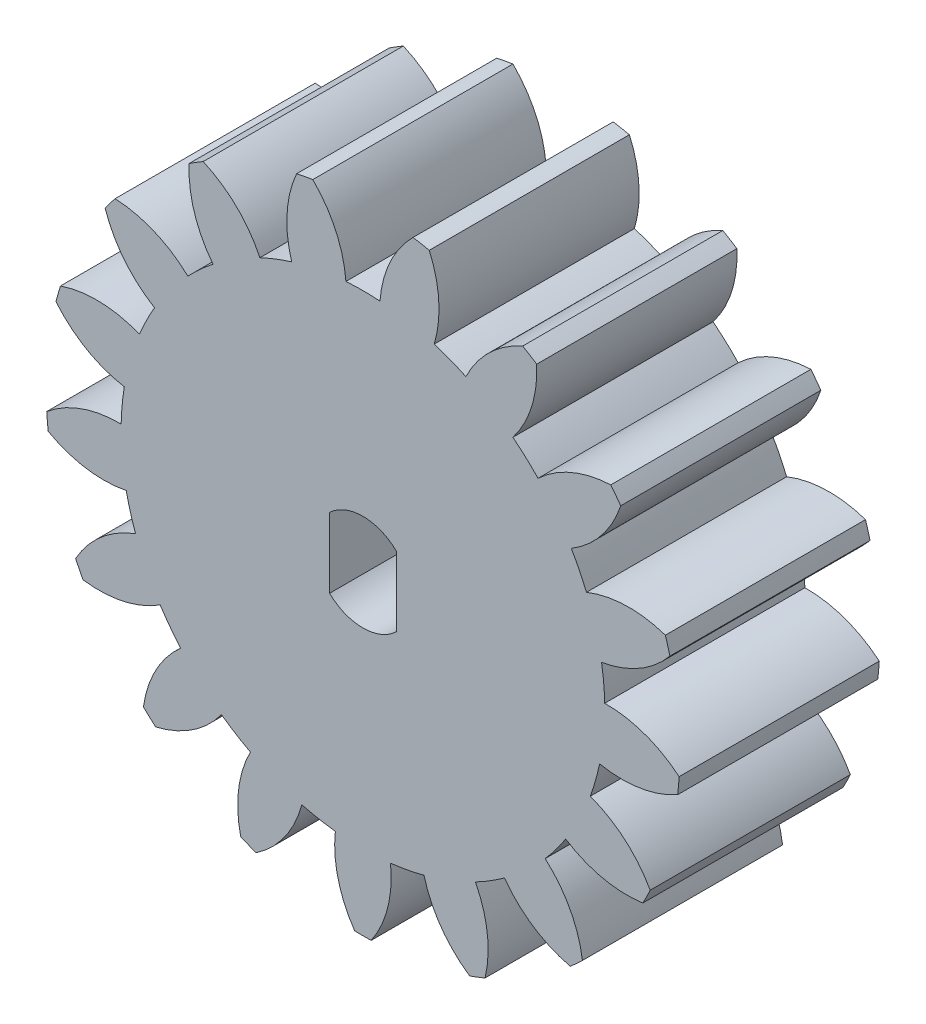
from build123d import *

# Parameters (mm, degrees)
SALIENTE_EXTRUIR1_DEPTH    = 12
CORTAR_EXTRUIR1_DEPTH      = 30.323828441
CORTAR_EXTRUIR1_DEPTH_BACK = 30.323828441


with BuildPart() as part:
    # Croquis2 → Saliente-Extruir1 (new body)
    with BuildSketch(Plane.XY):
        with BuildLine():
            ThreePointArc((-18.403869346, 4.841504781), (-16.568558398, 3.287756261), (-14.307209233, 2.469953906))
            ThreePointArc((-14.307209233, 2.469953906), (-14.437149822, 1.457270995), (-14.495501716, 0.437954415))
            ThreePointArc((-14.495501716, 0.437954415), (-16.868617902, 0.049598518), (-18.958179734, -1.140456979))
            ThreePointArc((-18.958179734, -1.140456979), (-18.91894935, -1.633626778), (-18.86689205, -2.125607989))
            ThreePointArc((-18.86689205, -2.125607989), (-16.594236855, -2.91144455), (-14.190167272, -2.857128995))
            ThreePointArc((-14.190167272, -2.857128995), (-13.94551, -3.848367642), (-13.631701901, -4.819931181))
            ThreePointArc((-13.631701901, -4.819931181), (-15.70427651, -6.039330716), (-17.22283726, -7.903861216))
            ThreePointArc((-17.22283726, -7.903861216), (-17.008102536, -8.349556708), (-16.781836437, -8.789510259))
            ThreePointArc((-16.781836437, -8.789510259), (-14.378771672, -8.70130328), (-12.15666459, -7.782205431))
            ThreePointArc((-12.15666459, -7.782205431), (-11.570451778, -8.618127541), (-10.926865208, -9.410723))
            ThreePointArc((-10.926865208, -9.410723), (-12.418985555, -11.296479508), (-13.161455179, -13.583669836))
            ThreePointArc((-13.161455179, -13.583669836), (-12.800217229, -13.921697376), (-12.430300822, -14.250205101))
            ThreePointArc((-12.430300822, -14.250205101), (-10.221373699, -13.299867423), (-8.481336993, -11.640116539))
            ThreePointArc((-8.481336993, -11.640116539), (-7.63273993, -12.207826199), (-6.746294822, -12.714409169))
            ThreePointArc((-6.746294822, -12.714409169), (-7.456441785, -15.011840784), (-7.322545645, -17.412793212))
            ThreePointArc((-7.322545645, -17.412793212), (-6.863591658, -17.597500307), (-6.399984203, -17.770195419))
            ThreePointArc((-6.399984203, -17.770195419), (-4.68352257, -16.086075411), (-3.660557838, -13.909830045))
            ThreePointArc((-3.660557838, -13.909830045), (-2.664184259, -14.132654921), (-1.654599937, -14.284808564))
            ThreePointArc((-1.654599937, -14.284808564), (-1.486864235, -16.683634417), (-0.494685747, -18.874087015))
            ThreePointArc((-0.494685747, -18.874087015), (0, -18.880527949), (0.494685747, -18.874087015))
            ThreePointArc((0.494685747, -18.874087015), (1.486864235, -16.683634417), (1.654599937, -14.284808564))
            ThreePointArc((1.654599937, -14.284808564), (2.664184259, -14.132654921), (3.660557838, -13.909830045))
            ThreePointArc((3.660557838, -13.909830045), (4.68352257, -16.086075411), (6.399984203, -17.770195419))
            ThreePointArc((6.399984203, -17.770195419), (6.863591658, -17.597500307), (7.322545645, -17.412793212))
            ThreePointArc((7.322545645, -17.412793212), (7.456441785, -15.011840784), (6.746294822, -12.714409169))
            ThreePointArc((6.746294822, -12.714409169), (7.63273993, -12.207826199), (8.481336993, -11.640116539))
            ThreePointArc((8.481336993, -11.640116539), (10.221373699, -13.299867423), (12.430300822, -14.250205101))
            ThreePointArc((12.430300822, -14.250205101), (12.800217229, -13.921697376), (13.161455179, -13.583669836))
            ThreePointArc((13.161455179, -13.583669836), (12.418985555, -11.296479508), (10.926865208, -9.410723))
            ThreePointArc((10.926865208, -9.410723), (11.570451778, -8.618127541), (12.15666459, -7.782205431))
            ThreePointArc((12.15666459, -7.782205431), (14.378771672, -8.70130328), (16.781836437, -8.789510259))
            ThreePointArc((16.781836437, -8.789510259), (17.008102536, -8.349556708), (17.22283726, -7.903861216))
            ThreePointArc((17.22283726, -7.903861216), (15.70427651, -6.039330716), (13.631701901, -4.819931181))
            ThreePointArc((13.631701901, -4.819931181), (13.94551, -3.848367642), (14.190167272, -2.857128995))
            ThreePointArc((14.190167272, -2.857128995), (16.594236855, -2.91144455), (18.86689205, -2.125607989))
            ThreePointArc((18.86689205, -2.125607989), (18.91894935, -1.633626778), (18.958179734, -1.140456979))
            ThreePointArc((18.958179734, -1.140456979), (16.868617902, 0.049598518), (14.495501716, 0.437954415))
            ThreePointArc((14.495501716, 0.437954415), (14.437149822, 1.457270995), (14.307209233, 2.469953906))
            ThreePointArc((14.307209233, 2.469953906), (16.568558398, 3.287756261), (18.403869346, 4.841504781))
            ThreePointArc((18.403869346, 4.841504781), (18.27468722, 5.319068863), (18.133114985, 5.793107654))
            ThreePointArc((18.133114985, 5.793107654), (15.754758974, 6.147964559), (13.401603701, 5.652827203))
            ThreePointArc((13.401603701, 5.652827203), (12.978972561, 6.582232472), (12.491983309, 7.479591209))
            ThreePointArc((12.491983309, 7.479591209), (14.305204321, 9.059062734), (15.455302108, 11.170880865))
            ThreePointArc((15.455302108, 11.170880865), (15.162327318, 11.569530143), (14.859072577, 11.960416361))
            ThreePointArc((14.859072577, 11.960416361), (12.513132546, 11.432149282), (10.497744846, 10.120389716))
            ThreePointArc((10.497744846, 10.120389716), (9.767913137, 10.834362342), (8.989645818, 11.495203635))
            ThreePointArc((8.989645818, 11.495203635), (10.109853132, 13.623027949), (10.419410679, 16.007702951))
            ThreePointArc((10.419410679, 16.007702951), (10.002211095, 16.27359763), (9.578230081, 16.528539926))
            ThreePointArc((9.578230081, 16.528539926), (7.58153823, 15.188494259), (6.17610738, 13.237272882))
            ThreePointArc((6.17610738, 13.237272882), (5.237642918, 13.639386906), (4.273206846, 13.974460476))
            ThreePointArc((4.273206846, 13.974460476), (4.549110257, 16.363263115), (3.976320102, 18.698731414))
            ThreePointArc((3.976320102, 18.698731414), (3.491240839, 18.795960945), (3.003794538, 18.880527949))
            ThreePointArc((3.003794538, 18.880527949), (1.626015166, 16.909684287), (1.020352389, 14.582524357))
            ThreePointArc((1.020352389, 14.582524357), (0, 14.618472051), (-1.020352389, 14.582524357))
            ThreePointArc((-1.020352389, 14.582524357), (-1.626015166, 16.909684287), (-3.003794538, 18.880527949))
            ThreePointArc((-3.003794538, 18.880527949), (-3.491240839, 18.795960945), (-3.976320102, 18.698731414))
            ThreePointArc((-3.976320102, 18.698731414), (-4.549110257, 16.363263115), (-4.273206846, 13.974460476))
            ThreePointArc((-4.273206846, 13.974460476), (-5.237642918, 13.639386906), (-6.17610738, 13.237272882))
            ThreePointArc((-6.17610738, 13.237272882), (-7.58153823, 15.188494259), (-9.578230081, 16.528539926))
            ThreePointArc((-9.578230081, 16.528539926), (-10.002211095, 16.27359763), (-10.419410679, 16.007702951))
            ThreePointArc((-10.419410679, 16.007702951), (-10.109853132, 13.623027949), (-8.989645818, 11.495203635))
            ThreePointArc((-8.989645818, 11.495203635), (-9.767913137, 10.834362342), (-10.497744846, 10.120389716))
            ThreePointArc((-10.497744846, 10.120389716), (-12.513132546, 11.432149282), (-14.859072577, 11.960416361))
            ThreePointArc((-14.859072577, 11.960416361), (-15.162327318, 11.569530143), (-15.455302108, 11.170880865))
            ThreePointArc((-15.455302108, 11.170880865), (-14.305204321, 9.059062734), (-12.491983309, 7.479591209))
            ThreePointArc((-12.491983309, 7.479591209), (-12.978972561, 6.582232472), (-13.401603701, 5.652827203))
            ThreePointArc((-13.401603701, 5.652827203), (-15.754758974, 6.147964559), (-18.133114985, 5.793107654))
            ThreePointArc((-18.133114985, 5.793107654), (-18.27468722, 5.319068863), (-18.403869346, 4.841504781))
        make_face()
    extrude(amount=SALIENTE_EXTRUIR1_DEPTH)

    # Croquis3 → Cortar-Extruir1 (cut, two sides: drawn at the far end of the back side and taken through both)
    with BuildSketch(Plane.XY.offset(12).offset(-CORTAR_EXTRUIR1_DEPTH_BACK)):
        with BuildLine():
            Line((-2, -2.1), (-2, 2.1))
            ThreePointArc((-2, 2.1), (0, 2.9), (2, 2.1))
            Line((2, 2.1), (2, -2.1))
            ThreePointArc((2, -2.1), (0, -2.9), (-2, -2.1))
        make_face()
    extrude(amount=CORTAR_EXTRUIR1_DEPTH + CORTAR_EXTRUIR1_DEPTH_BACK, mode=Mode.SUBTRACT)


solid = part.part
